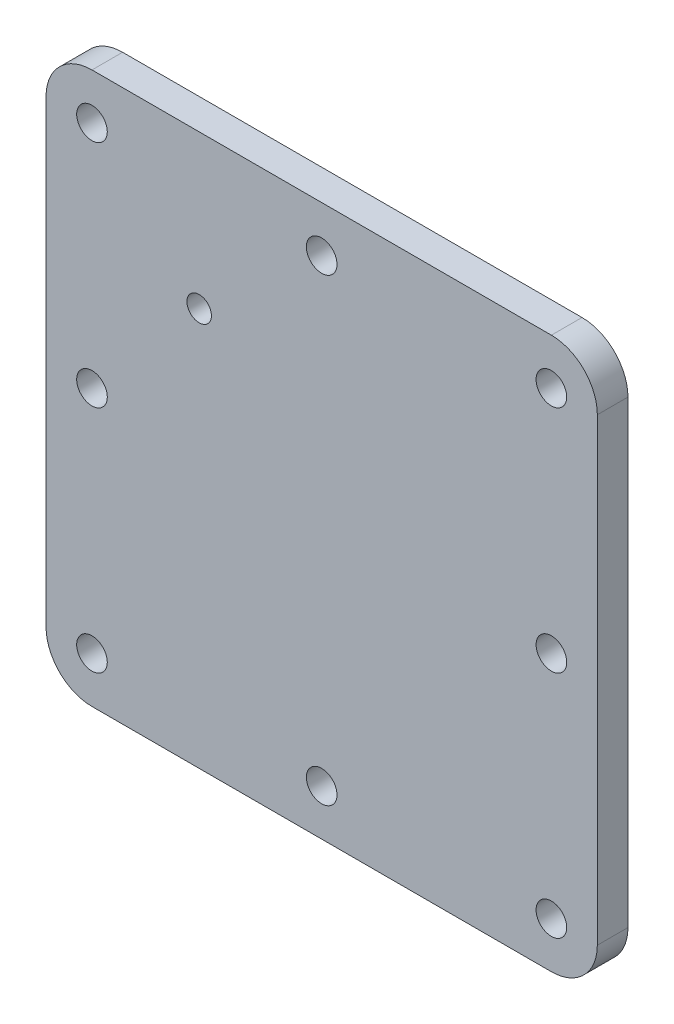
from build123d import *

# Parameters (mm, degrees)
SKETCH2_R           = 5
BOSS_EXTRUDE1_DEPTH = 10
SKETCH4_R           = 4
CUT_EXTRUDE1_DEPTH  = 10


with BuildPart() as part:
    # Sketch2 → Boss-Extrude1 (new body)
    with BuildSketch(Plane.XY):
        with BuildLine():
            Line((-75, 90), (75, 90))
            ThreePointArc((75, 90), (85.606601718, 85.606601718), (90, 75))
            Line((90, 75), (90, -75))
            ThreePointArc((90, -75), (85.606601718, -85.606601718), (75, -90))
            Line((75, -90), (-75, -90))
            ThreePointArc((-75, -90), (-85.606601718, -85.606601718), (-90, -75))
            Line((-90, -75), (-90, 75))
            ThreePointArc((-90, 75), (-85.606601718, 85.606601718), (-75, 90))
        make_face()
        with Locations((-75, 75)):
            Circle(SKETCH2_R, mode=Mode.SUBTRACT)
        with Locations((0, 75)):
            Circle(SKETCH2_R, mode=Mode.SUBTRACT)
        with Locations((75, 75)):
            Circle(SKETCH2_R, mode=Mode.SUBTRACT)
        with Locations((-75, 0)):
            Circle(SKETCH2_R, mode=Mode.SUBTRACT)
        with Locations((75, 0)):
            Circle(SKETCH2_R, mode=Mode.SUBTRACT)
        with Locations((-75, -75)):
            Circle(SKETCH2_R, mode=Mode.SUBTRACT)
        with Locations((0, -75)):
            Circle(SKETCH2_R, mode=Mode.SUBTRACT)
        with Locations((75, -75)):
            Circle(SKETCH2_R, mode=Mode.SUBTRACT)
    extrude(amount=BOSS_EXTRUDE1_DEPTH)

    # Sketch4 → Cut-Extrude1 (cut)
    with BuildSketch(Plane.XY.offset(10)):
        with Locations((-40, 40)):
            Circle(SKETCH4_R)
    extrude(amount=-CUT_EXTRUDE1_DEPTH, mode=Mode.SUBTRACT)


solid = part.part
